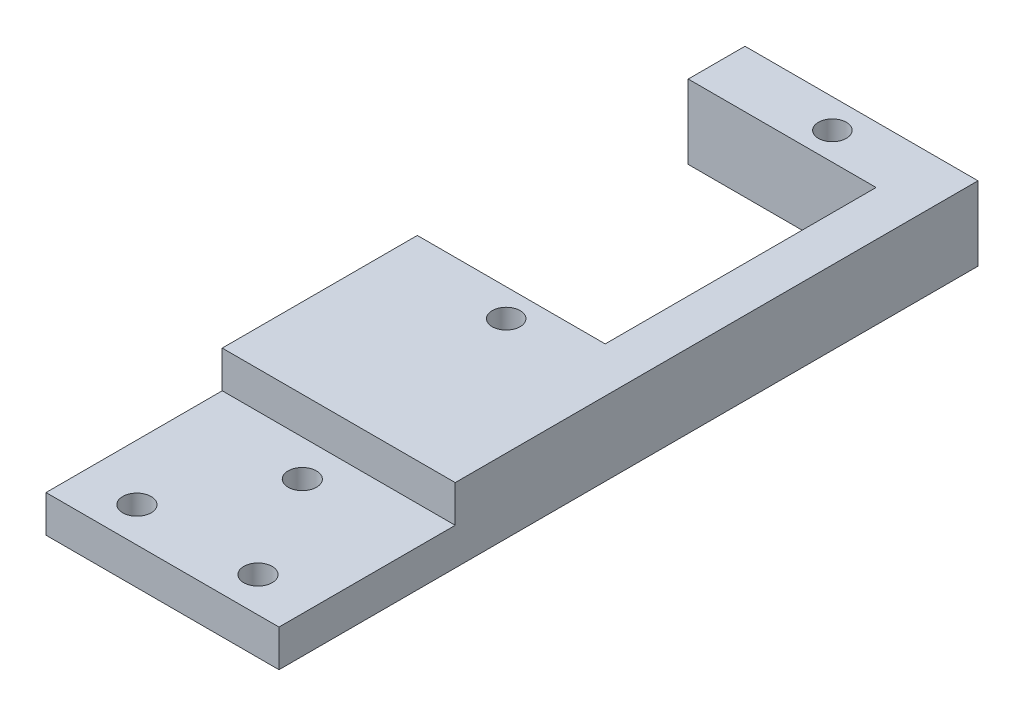
from build123d import *

# Parameters (mm, degrees)
SKETCH2_W                = 20
SKETCH2_H                = 60
BOSS_EXTRUDE1_DEPTH      = 6.35
SKETCH4_W                = 16.127
SKETCH4_H                = 23.254
CUT_EXTRUDE1_DEPTH       = 64.563531211
M2_CLEARANCE_HOLE1_D     = 2.4
M2_CLEARANCE_HOLE1_DEPTH = 5
M2_CLEARANCE_HOLE1_TIP   = 0.721032743
SKETCH10_W               = 15.127
SKETCH10_H               = 3.175
CUT_EXTRUDE2_DEPTH       = 64.563531211
F_2_CLEARANCE_HOLE1_D    = 2.4384


with BuildPart() as part:
    # Sketch2 → Boss-Extrude1 (new body)
    with BuildSketch(Plane(origin=(0, 0, 0), x_dir=(1, 0, 0), z_dir=(0, 1, 0))):
        with Locations((10, -30)):
            Rectangle(SKETCH2_W, SKETCH2_H)
    extrude(amount=BOSS_EXTRUDE1_DEPTH)

    # Sketch4 → Cut-Extrude1 (cut, through all)
    with BuildSketch(Plane(origin=(0, 6.35, 0), x_dir=(1, 0, 0), z_dir=(0, 1, 0))):
        with Locations((8.0635, -16.5)):
            Rectangle(SKETCH4_W, SKETCH4_H)
    extrude(amount=-CUT_EXTRUDE1_DEPTH, mode=Mode.SUBTRACT)

    # M2 Clearance Hole1
    with Locations(Plane(origin=(0, 6.35, 0), x_dir=(1, 0, 0), z_dir=(0, 1, 0))):
        with Locations((10, -30.5), (10, -2.5)):
            Hole(M2_CLEARANCE_HOLE1_D / 2, depth=M2_CLEARANCE_HOLE1_DEPTH)
            with Locations((0, 0, -(M2_CLEARANCE_HOLE1_DEPTH + M2_CLEARANCE_HOLE1_TIP / 2))):  # 118° drill point
                Cone(0, M2_CLEARANCE_HOLE1_D / 2, M2_CLEARANCE_HOLE1_TIP, mode=Mode.SUBTRACT)

    # Sketch10 → Cut-Extrude2 (cut, through all)
    with BuildSketch(Plane(origin=(20, 0, 0), x_dir=(0, 0, -1), z_dir=(1, 0, 0))):
        with Locations((-52.4365, 4.7625)):
            Rectangle(SKETCH10_W, SKETCH10_H)
    extrude(amount=-CUT_EXTRUDE2_DEPTH, mode=Mode.SUBTRACT)

    # #2 Clearance Hole1 (through all)
    with Locations(Plane(origin=(0, 3.175, 0), x_dir=(1, 0, 0), z_dir=(0, 1, 0))):
        with Locations((10, -48), (4.803847577, -57), (15.196152423, -57)):
            Hole(F_2_CLEARANCE_HOLE1_D / 2)


solid = part.part
